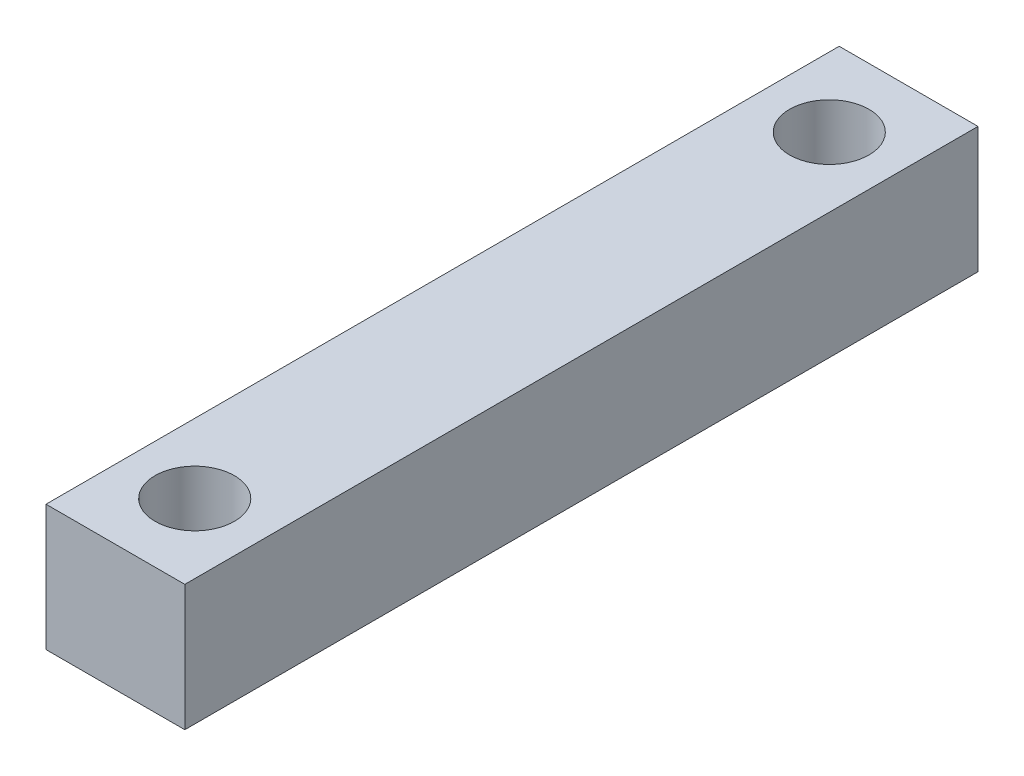
from build123d import *

# Parameters (mm, degrees)
SKETCH1_W           = 7
SKETCH1_H           = 40
BOSS_EXTRUDE1_DEPTH = 3.175
SKETCH2_W           = 7
SKETCH2_H           = 40
SKETCH2_R           = 2
BOSS_EXTRUDE2_DEPTH = 3.175


with BuildPart() as part:
    # Sketch1 → Boss-Extrude1 (new body)
    with BuildSketch(Plane(origin=(0, 0, 0), x_dir=(1, 0, 0), z_dir=(0, 1, 0))):
        Rectangle(SKETCH1_W, SKETCH1_H)
    extrude(amount=BOSS_EXTRUDE1_DEPTH)

    # Sketch2 → Boss-Extrude2 (add)
    with BuildSketch(Plane(origin=(0, 3.175, 0), x_dir=(1, 0, 0), z_dir=(0, 1, 0))):
        Rectangle(SKETCH2_W, SKETCH2_H)
        with Locations(Location((0, 16, 0), (0, 0, 270))):
            Circle(SKETCH2_R, mode=Mode.SUBTRACT)
        with Locations(Location((0, -16, 0), (0, 0, 270))):
            Circle(SKETCH2_R, mode=Mode.SUBTRACT)
    extrude(amount=BOSS_EXTRUDE2_DEPTH)


solid = part.part
